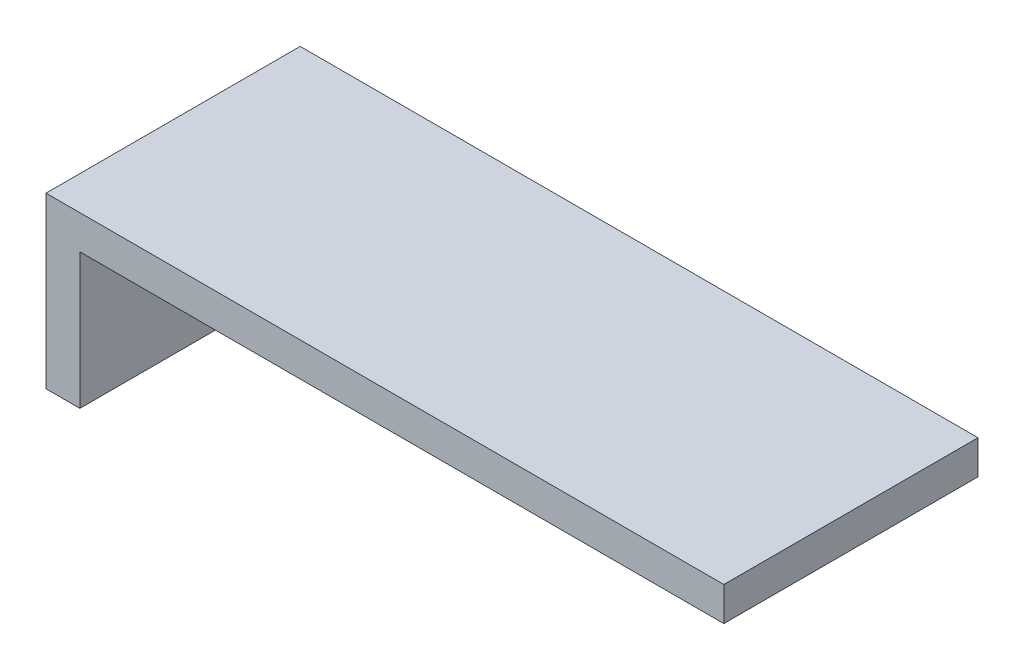
from build123d import *

# Parameters (mm, degrees)
SKETCH1_W           = 40
SKETCH1_H           = 15
BOSS_EXTRUDE1_DEPTH = 2
SKETCH2_W           = 2
SKETCH2_H           = 15
BOSS_EXTRUDE2_DEPTH = 8


with BuildPart() as part:
    # Sketch1 → Boss-Extrude1 (new body)
    with BuildSketch(Plane(origin=(0, 0, 0), x_dir=(1, 0, 0), z_dir=(0, 1, 0))):
        with Locations((20, 7.5)):
            Rectangle(SKETCH1_W, SKETCH1_H)
    extrude(amount=BOSS_EXTRUDE1_DEPTH)

    # Sketch2 → Boss-Extrude2 (add)
    with BuildSketch(Plane.XZ):
        with Locations((1, -7.5)):
            Rectangle(SKETCH2_W, SKETCH2_H)
    extrude(amount=BOSS_EXTRUDE2_DEPTH)


solid = part.part
